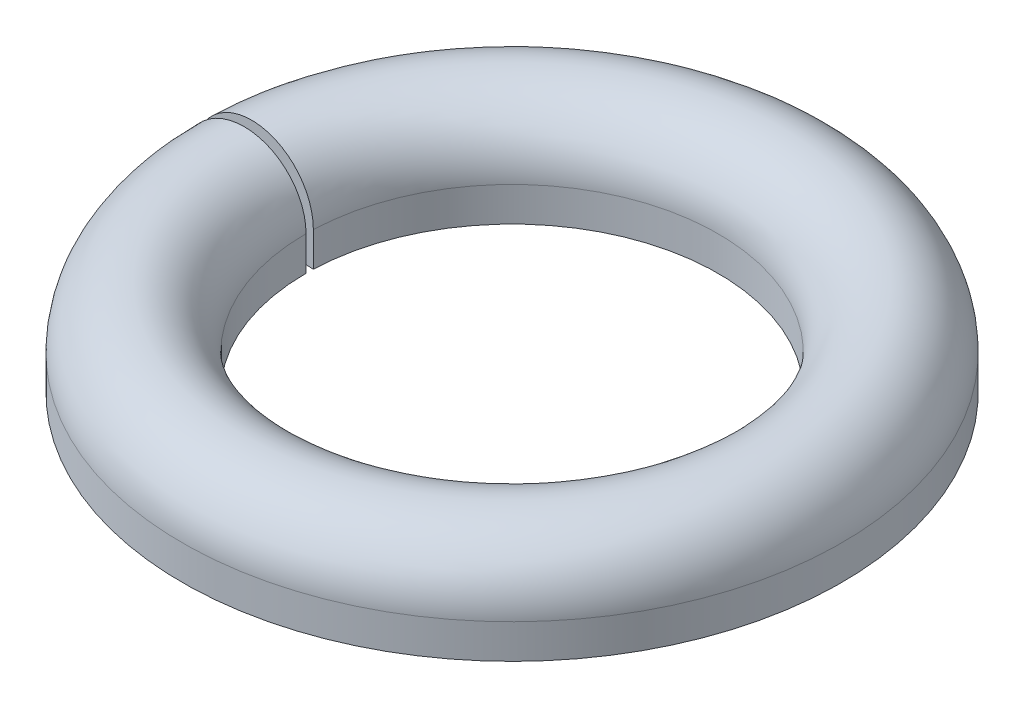
from build123d import *

# Parameters (mm, degrees)
REVOLVE1_ANGLE = 358


with BuildPart() as part:
    # Sketch1 → Revolve1 (revolve)
    with BuildSketch(Plane.XY):
        with BuildLine():
            Line((-15, 0), (-24, 0))
            Line((-24, 0), (-24, 2.5))
            ThreePointArc((-24, 2.5), (-19.5, 7), (-15, 2.5))
            Line((-15, 2.5), (-15, 0))
        make_face()
        with BuildLine():
            Line((-16.5, 1.5), (-16.5, 2.5))
            ThreePointArc((-16.5, 2.5), (-19.5, 5.5), (-22.5, 2.5))
            Line((-22.5, 2.5), (-22.5, 1.5))
            Line((-22.5, 1.5), (-16.5, 1.5))
        make_face(mode=Mode.SUBTRACT)
    revolve(axis=Axis((0, 0, 0), (0, 1, 0)), revolution_arc=REVOLVE1_ANGLE)


solid = part.part
